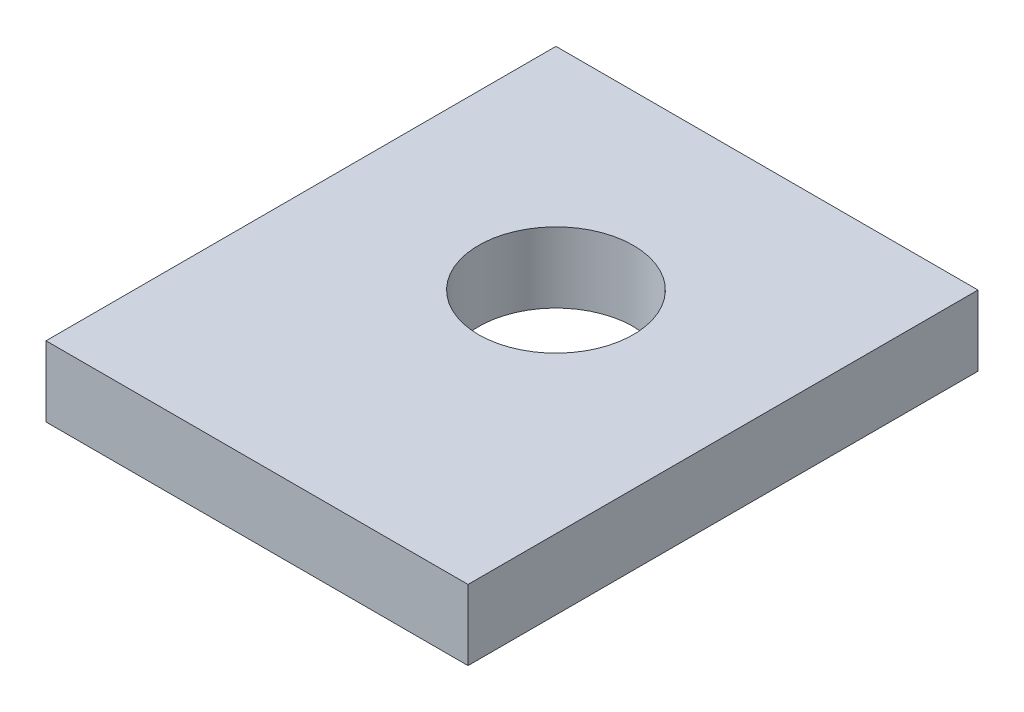
from build123d import *

# Parameters (mm, degrees)
MAIN_PROFILE_SKETCH_W = 6
MAIN_PROFILE_SKETCH_H = 7.25
MAIN_PROFILE_SKETCH_R = 1.1
MAIN_EXTRUSION_DEPTH  = 1


with BuildPart() as part:
    # Main Profile Sketch → Main Extrusion (new body)
    with BuildSketch(Plane(origin=(0, -203.2, 0), x_dir=(-1, 0, 0), z_dir=(0, -1, 0))):
        with Locations((19.009182883, 67.119882879)):
            Rectangle(MAIN_PROFILE_SKETCH_W, MAIN_PROFILE_SKETCH_H)
        with Locations(Location((19.009182883, 67.744882879, 0), (0, 0, 90))):
            Circle(MAIN_PROFILE_SKETCH_R, mode=Mode.SUBTRACT)
    extrude(amount=MAIN_EXTRUSION_DEPTH)


solid = part.part
